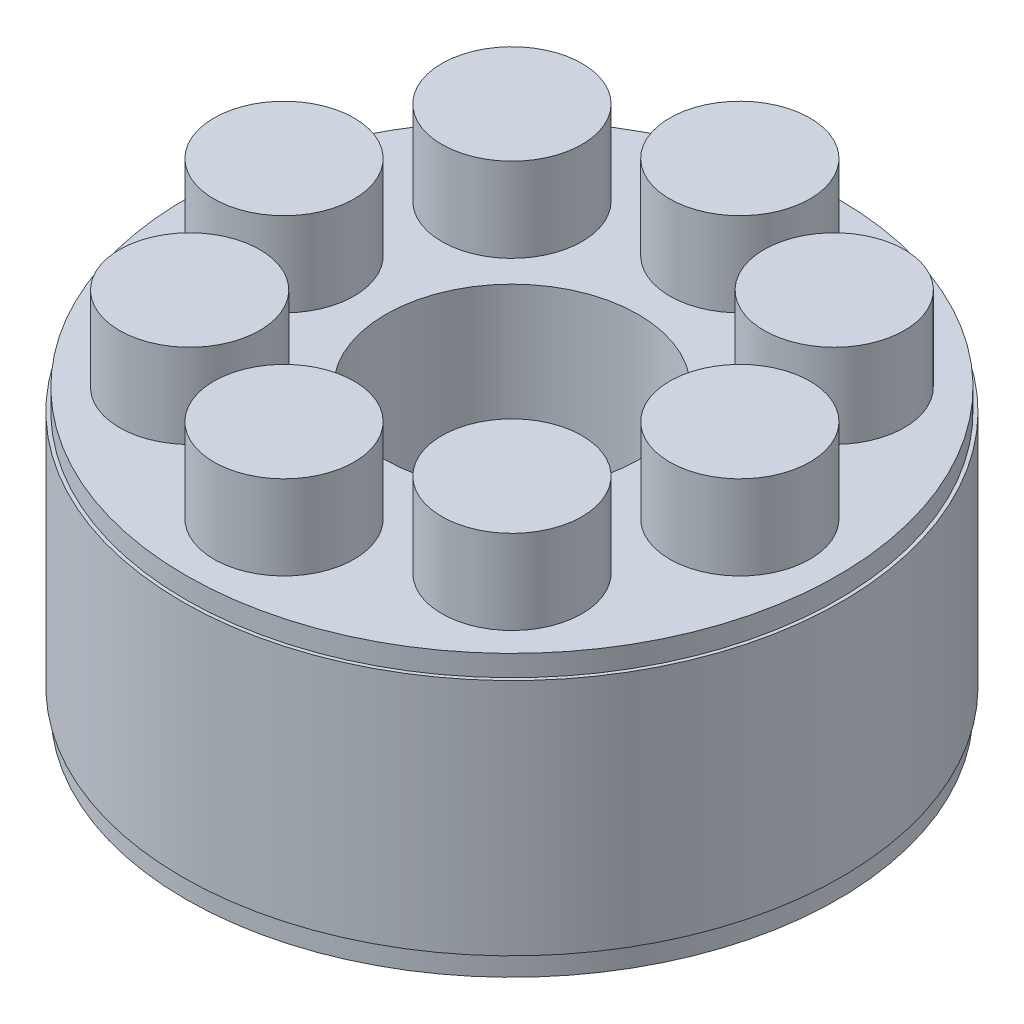
from build123d import *

# Parameters (mm, degrees)
SKETCH_1_R               = 23.25
SKETCH_1_R_2             = 9
EXTRUDE_1_DEPTH          = 10
SKETCH_2_R               = 5
EXTRUDE_2_DEPTH          = 6
PATTERN_CIRCULAR_1_COUNT = 8
SKETCH_4_R               = 23.5
SKETCH_4_R_2             = 9
EXTRUDE_3_DEPTH          = 8.5


with BuildPart() as part:
    # 草图1 → 凸台-拉伸1 (new, symmetric)
    with BuildSketch(Plane(origin=(0, 0, 0), x_dir=(1, 0, 0), z_dir=(0, 1, 0))):
        with Locations(Location((0, 0, 0), (0, 0, 270))):
            Circle(SKETCH_1_R)
        with Locations(Location((0, 0, 0), (0, 0, 270))):
            Circle(SKETCH_1_R_2, mode=Mode.SUBTRACT)
    extrude(amount=EXTRUDE_1_DEPTH, both=True)

    # 草图2 → 凸台-拉伸2 (add)
    with BuildSketch(Plane(origin=(0, 10, 0), x_dir=(1, 0, 0), z_dir=(0, 1, 0))):
        with Locations(Location((16.25, 0, 0), (0, 0, 270))):
            Circle(SKETCH_2_R)
    extrude_2 = extrude(amount=EXTRUDE_2_DEPTH)

    # 阵列(圆周)1: 凸台-拉伸2 ×8 about axis
    pattern_circular_1_axis = Axis((0, 0, 0), (0, 1, 0))
    for i in range(1, PATTERN_CIRCULAR_1_COUNT):
        add(extrude_2.rotate(pattern_circular_1_axis, i * 360 / PATTERN_CIRCULAR_1_COUNT))

    # 草图4 → 凸台-拉伸3 (add, symmetric)
    with BuildSketch(Plane(origin=(0, 0, 0), x_dir=(1, 0, 0), z_dir=(0, 1, 0))):
        with Locations(Location((0, 0, 0), (0, 0, 270))):
            Circle(SKETCH_4_R)
        with Locations(Location((0, 0, 0), (0, 0, 270))):
            Circle(SKETCH_4_R_2, mode=Mode.SUBTRACT)
    extrude(amount=EXTRUDE_3_DEPTH, both=True)


solid = part.part
